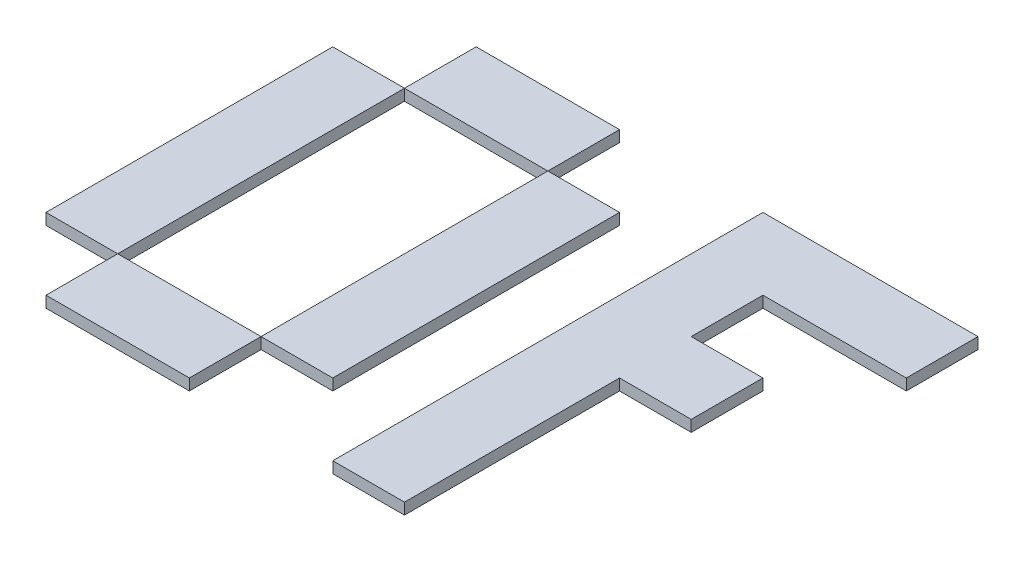
from build123d import *

# Parameters (mm, degrees)
SKETCH1_W           = 127
SKETCH1_H           = 203.2
BOSS_EXTRUDE1_DEPTH = 2
SKETCH2_W           = 127
SKETCH2_H           = 203.2
CUT_EXTRUDE9_DEPTH  = 2
SKETCH5_W           = 25.4
SKETCH5_H           = 50.8
CUT_EXTRUDE10_DEPTH = 2


with BuildPart() as part:
    # Sketch1 → Boss-Extrude1 (new body)
    with BuildSketch(Plane(origin=(0, 0, 0), x_dir=(1, 0, 0), z_dir=(0, 1, 0))):
        with Locations((63.5, 101.6)):
            Rectangle(SKETCH1_W, SKETCH1_H)
    extrude(amount=BOSS_EXTRUDE1_DEPTH)

    # Sketch2 → Cut-Extrude9 (cut)
    with BuildSketch(Plane(origin=(0, 2, 0), x_dir=(1, 0, 0), z_dir=(0, 1, 0))):
        with Locations((63.5, 101.6)):
            Rectangle(SKETCH2_W, SKETCH2_H)
        Polygon((50.8, 127), (63.5, 127), (63.5, 76.2), (50.8, 76.2), (50.8, 63.5), (25.4, 63.5), (25.4, 76.2), (12.7, 76.2), (12.7, 127), (25.4, 127), (25.4, 139.7), (50.8, 139.7), align=None, mode=Mode.SUBTRACT)
        Polygon((88.9, 101.6), (101.6, 101.6), (101.6, 114.3), (88.9, 114.3), (88.9, 127), (114.3, 127), (114.3, 139.7), (88.9, 139.7), (76.2, 139.7), (76.2, 63.5), (88.9, 63.5), align=None, mode=Mode.SUBTRACT)
    extrude(amount=-CUT_EXTRUDE9_DEPTH, mode=Mode.SUBTRACT)


with BuildPart() as cut_extrude9_piece_1:
    # of the separate pieces the step leaves, piece 1, a body of its own (cut_extrude9_pieces)
    add(part.part.solids().sort_by_distance((50.8, 0, -127))[0])

    # Sketch5 → Cut-Extrude10 (cut)
    with BuildSketch(Plane(origin=(0, 2, 0), x_dir=(1, 0, 0), z_dir=(0, 1, 0))):
        with Locations((38.1, 101.6)):
            Rectangle(SKETCH5_W, SKETCH5_H)
    extrude(amount=-CUT_EXTRUDE10_DEPTH, mode=Mode.SUBTRACT)


with BuildPart() as cut_extrude9_piece_2:
    # of the separate pieces the step leaves, piece 2, a body of its own (cut_extrude9_pieces)
    add(part.part.solids().sort_by_distance((76.2, 0, -63.5))[0])


with BuildPart() as cut_extrude10_piece_1:
    # of the separate pieces the step leaves, piece 1, a body of its own (cut_extrude10_pieces)
    add(cut_extrude9_piece_1.part.solids().sort_by_distance((63.5, 0, -127))[0])


with BuildPart() as cut_extrude10_piece_2:
    # of the separate pieces the step leaves, piece 2, a body of its own (cut_extrude10_pieces)
    add(cut_extrude9_piece_1.part.solids().sort_by_distance((12.7, 0, -76.2))[0])


with BuildPart() as cut_extrude10_piece_3:
    # of the separate pieces the step leaves, piece 3, a body of its own (cut_extrude10_pieces)
    add(cut_extrude9_piece_1.part.solids().sort_by_distance((50.8, 0, -63.5))[0])


with BuildPart() as cut_extrude10_piece_4:
    # of the separate pieces the step leaves, piece 4, a body of its own (cut_extrude10_pieces)
    add(cut_extrude9_piece_1.part.solids().sort_by_distance((25.4, 0, -139.7))[0])


solid = Compound([cut_extrude9_piece_2.part, cut_extrude10_piece_1.part, cut_extrude10_piece_2.part, cut_extrude10_piece_3.part, cut_extrude10_piece_4.part])
